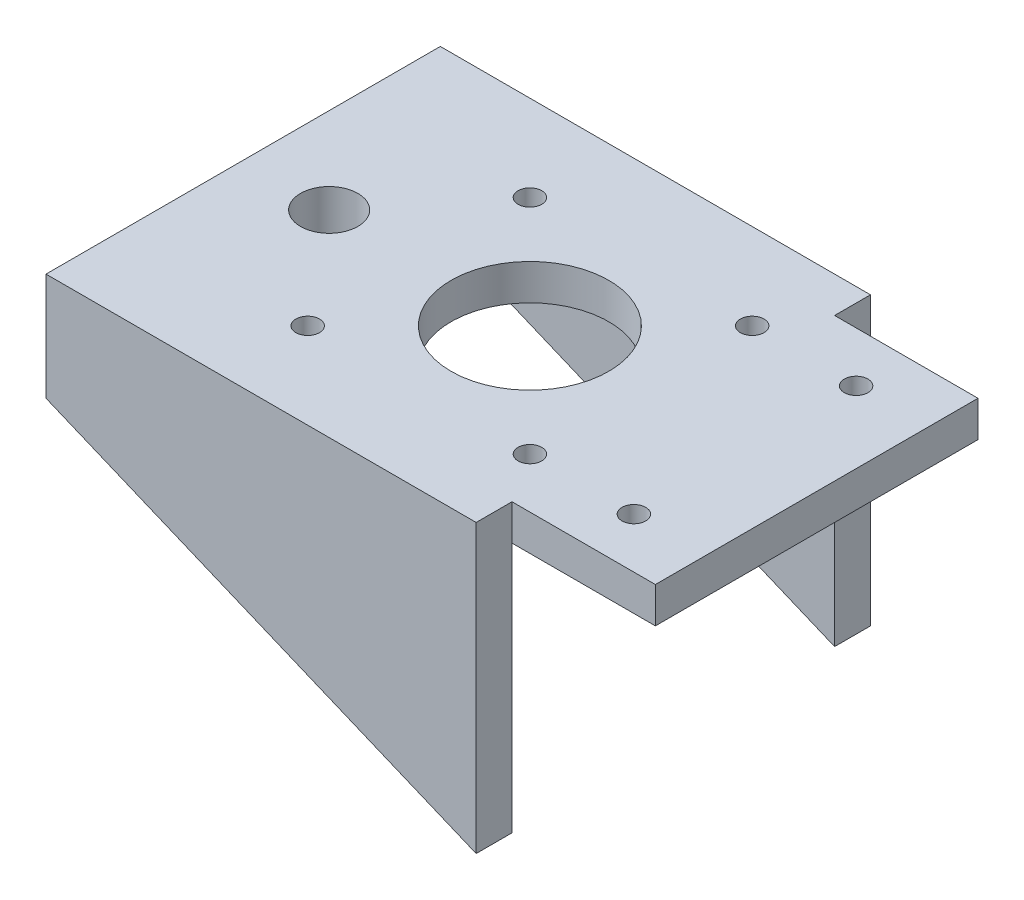
from build123d import *

# Parameters (mm, degrees)
SKETCH_1_W          = 80
SKETCH_1_H          = 45
EXTRUDE_1_DEPTH     = 5
SKETCH_2_R          = 1.65
SKETCH_2_R_2        = 4
SKETCH_2_R_3        = 11
CUT_EXTRUDE_1_DEPTH = 47.165463282
SKETCH_3_R          = 7.5
SKETCH_3_R_2        = 4
EXTRUDE_2_DEPTH     = 10
EXTRUDE_4_DEPTH     = 5


with BuildPart() as part:
    # 草图1 → 凸台-拉伸1 (new body)
    with BuildSketch(Plane(origin=(0, 0, 0), x_dir=(1, 0, 0), z_dir=(0, 1, 0))):
        Rectangle(SKETCH_1_W, SKETCH_1_H)
    extrude(amount=EXTRUDE_1_DEPTH)

    # 草图2 → 切除-拉伸1 (cut, through all)
    with BuildSketch(Plane(origin=(0, 5, 0), x_dir=(1, 0, 0), z_dir=(0, 1, 0))):
        with Locations(Location((-15.5, 15.5, 0), (0, 0, 270))):
            Circle(SKETCH_2_R)
        with Locations(Location((15.5, 15.5, 0), (0, 0, 270))):
            Circle(SKETCH_2_R)
        with Locations(Location((15.5, -15.5, 0), (0, 0, 270))):
            Circle(SKETCH_2_R)
        with Locations(Location((-15.5, -15.5, 0), (0, 0, 270))):
            Circle(SKETCH_2_R)
        with Locations(Location((30, 15.5, 0), (0, 0, 270))):
            Circle(SKETCH_2_R)
        with Locations(Location((30, -15.5, 0), (0, 0, 270))):
            Circle(SKETCH_2_R)
        with Locations(Location((-28, 0, 0), (0, 0, 270))):
            Circle(SKETCH_2_R_2)
        with Locations(Location((0, 0, 0), (0, 0, 270))):
            Circle(SKETCH_2_R_3)
    extrude(amount=-CUT_EXTRUDE_1_DEPTH, mode=Mode.SUBTRACT)

    # 草图3 → 凸台-拉伸2 (add)
    with BuildSketch(Plane.XZ):
        with Locations(Location((-28, 0, 0), (0, 0, 90))):
            Circle(SKETCH_3_R)
        with Locations(Location((-28, 0, 0), (0, 0, 90))):
            Circle(SKETCH_3_R_2, mode=Mode.SUBTRACT)
    extrude(amount=EXTRUDE_2_DEPTH)

    # 草图6 → 凸台-拉伸4 (add)
    with BuildSketch(Plane.XY.offset(22.5)):
        Polygon((-40, 5), (-40, -10), (20, -35), (20, 5), align=None)
    extrude_4 = extrude(amount=EXTRUDE_4_DEPTH)

    # 镜向1: 凸台-拉伸4 across plane
    add(extrude_4.mirror(Plane(origin=(0, 0, 0), x_dir=(1, 0, 0), z_dir=(0, 0, -1))))


solid = part.part
